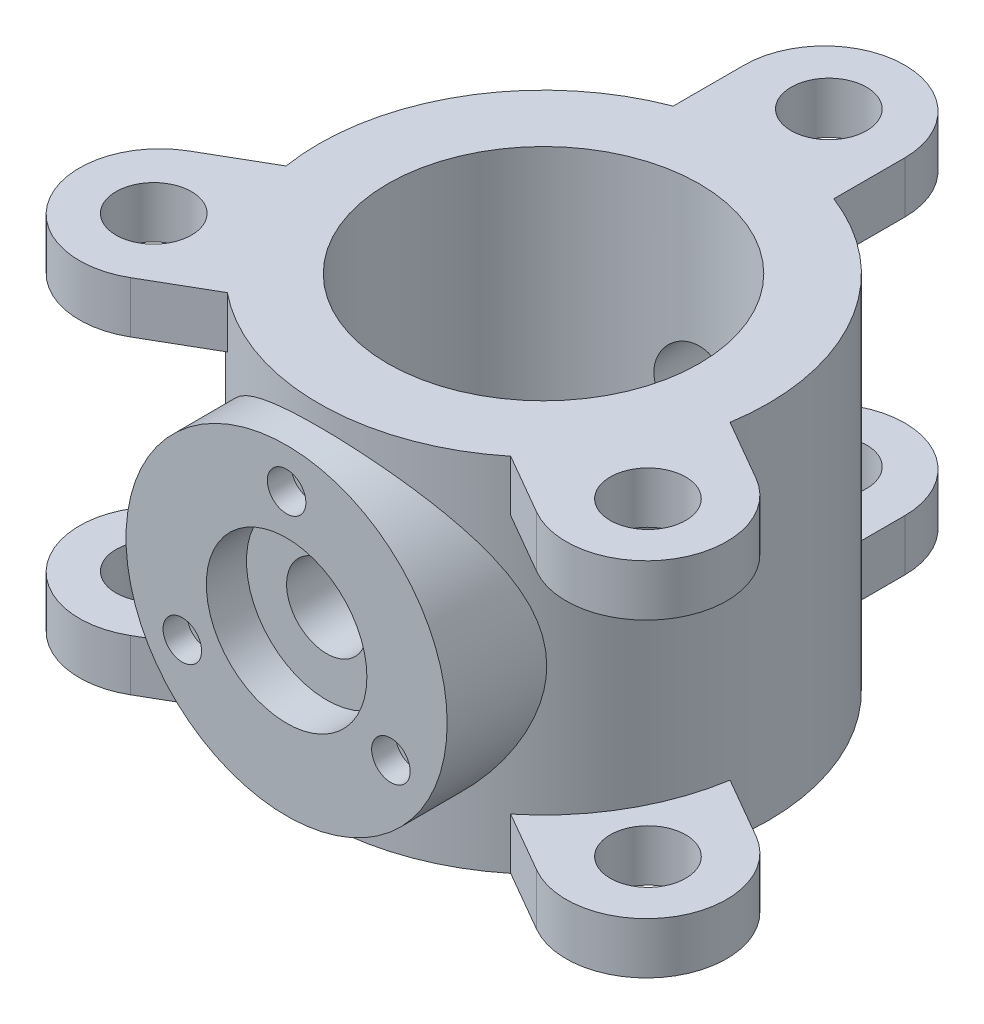
from build123d import *

# Parameters (mm, degrees)
SKETCH1_R                = 140
SKETCH1_R_2              = 97
BOSS_EXTRUDE1_DEPTH      = 225
SKETCH3_R                = 23.5
BOSS_EXTRUDE3_DEPTH      = 32
CIRPATTERN1_COUNT        = 3
MIRROR1_COPY_1_SKETCH_R  = 23.5
MIRROR1_COPY_1_DEPTH     = 32
MIRROR1_COPY_2_SKETCH_R  = 23.5
MIRROR1_COPY_2_DEPTH     = 32
BOSS_EXTRUDE4_REACH      = 491.361
BOSS_EXTRUDE4_END_RADIUS = 140
SKETCH4_R                = 100
SKETCH5_R                = 50
CUT_EXTRUDE1_DEPTH       = 25
SKETCH6_R                = 25
CUT_EXTRUDE2_DEPTH       = 490.361006427
SKETCH7_R                = 12
CUT_EXTRUDE3_DEPTH       = 15


with BuildPart() as part:
    # Sketch1 → Boss-Extrude1 (new body)
    with BuildSketch(Plane(origin=(0, 0, 0), x_dir=(1, 0, 0), z_dir=(0, 1, 0))):
        with Locations(Location((0, 0, 0), (0, 0, 270))):
            Circle(SKETCH1_R)
        with Locations(Location((0, 0, 0), (0, 0, 270))):
            Circle(SKETCH1_R_2, mode=Mode.SUBTRACT)
    extrude(amount=BOSS_EXTRUDE1_DEPTH)

    # Sketch3 → Boss-Extrude3 (add)
    with BuildSketch(Plane(origin=(0, 225, 0), x_dir=(1, 0, 0), z_dir=(0, 1, 0))):
        with BuildLine():
            Line((-50, 175), (-50, 101.528699727))
            Line((-50, 101.528699727), (50, 101.528699727))
            Line((50, 101.528699727), (50, 175))
            ThreePointArc((50, 175), (0, 225), (-50, 175))
        make_face()
        with Locations(Location((0, 177.702584928, 0), (0, 0, 270))):
            Circle(SKETCH3_R, mode=Mode.SUBTRACT)
    boss_extrude3 = extrude(amount=-BOSS_EXTRUDE3_DEPTH)

    # CirPattern1: Boss-Extrude3 ×3 about axis
    cirpattern1_axis = Axis((0, 0, 0), (0, 1, 0))
    for i in range(1, CIRPATTERN1_COUNT):
        add(boss_extrude3.rotate(cirpattern1_axis, i * 360 / CIRPATTERN1_COUNT))

    # Mirror1: Boss-Extrude3 across plane
    add(boss_extrude3.mirror(Plane.ZX.offset(112.5)))

    # Mirror1 copy 1 sketch → Mirror1 copy 1 (add)
    with BuildSketch(Plane(origin=(0, 0, 0), x_dir=(-0.4999999999999998, 0, -0.8660254037844387), z_dir=(0, -1, 0))):
        with BuildLine():
            Line((-50, -175), (-50, -101.528699727))
            Line((-50, -101.528699727), (50, -101.528699727))
            Line((50, -101.528699727), (50, -175))
            ThreePointArc((50, -175), (0, -225), (-50, -175))
        make_face()
        with Locations((0, -177.702584928)):
            Circle(MIRROR1_COPY_1_SKETCH_R, mode=Mode.SUBTRACT)
    extrude(amount=-MIRROR1_COPY_1_DEPTH)

    # Mirror1 copy 2 sketch → Mirror1 copy 2 (add)
    with BuildSketch(Plane(origin=(0, 0, 0), x_dir=(-0.5000000000000004, 0, 0.8660254037844384), z_dir=(0, -1, 0))):
        with BuildLine():
            Line((-50, -175), (-50, -101.528699727))
            Line((-50, -101.528699727), (50, -101.528699727))
            Line((50, -101.528699727), (50, -175))
            ThreePointArc((50, -175), (0, -225), (-50, -175))
        make_face()
        with Locations((0, -177.702584928)):
            Circle(MIRROR1_COPY_2_SKETCH_R, mode=Mode.SUBTRACT)
    extrude(amount=-MIRROR1_COPY_2_DEPTH)

    # Boss-Extrude4: up to this cylinder (the profile starts outside it)
    boss_extrude4_end = Plane(origin=(0, 112.5, 0), z_dir=(0, -1, 0)) * Cylinder(BOSS_EXTRUDE4_END_RADIUS, 1263.722, mode=Mode.PRIVATE)
    # Sketch4 → Boss-Extrude4 (add, up to the surface)
    with BuildSketch(Plane.XY.offset(160), mode=Mode.PRIVATE) as boss_extrude4_sk1:
        with Locations((0, 112.5)):
            Circle(SKETCH4_R)
    boss_extrude4_tool1 = extrude(boss_extrude4_sk1.sketch, amount=-BOSS_EXTRUDE4_REACH, mode=Mode.PRIVATE) - boss_extrude4_end
    add(boss_extrude4_tool1.solids().sort_by_distance((0, 112.5, 160))[0])

    # Sketch5 → Cut-Extrude1 (cut)
    with BuildSketch(Plane.XY.offset(160)):
        with Locations((0, 112.5)):
            Circle(SKETCH5_R)
    extrude(amount=-CUT_EXTRUDE1_DEPTH, mode=Mode.SUBTRACT)

    # Sketch6 → Cut-Extrude2 (cut, through all)
    with BuildSketch(Plane.XY.offset(160)):
        with Locations((0, 112.5)):
            Circle(SKETCH6_R)
    extrude(amount=-CUT_EXTRUDE2_DEPTH, mode=Mode.SUBTRACT)

    # Sketch7 → Cut-Extrude3 (cut)
    with BuildSketch(Plane.XY.offset(160)):
        with Locations((0, 187.5)):
            Circle(SKETCH7_R)
        with Locations((64.951905284, 75)):
            Circle(SKETCH7_R)
        with Locations((-64.951905284, 75)):
            Circle(SKETCH7_R)
    extrude(amount=-CUT_EXTRUDE3_DEPTH, mode=Mode.SUBTRACT)


solid = part.part
